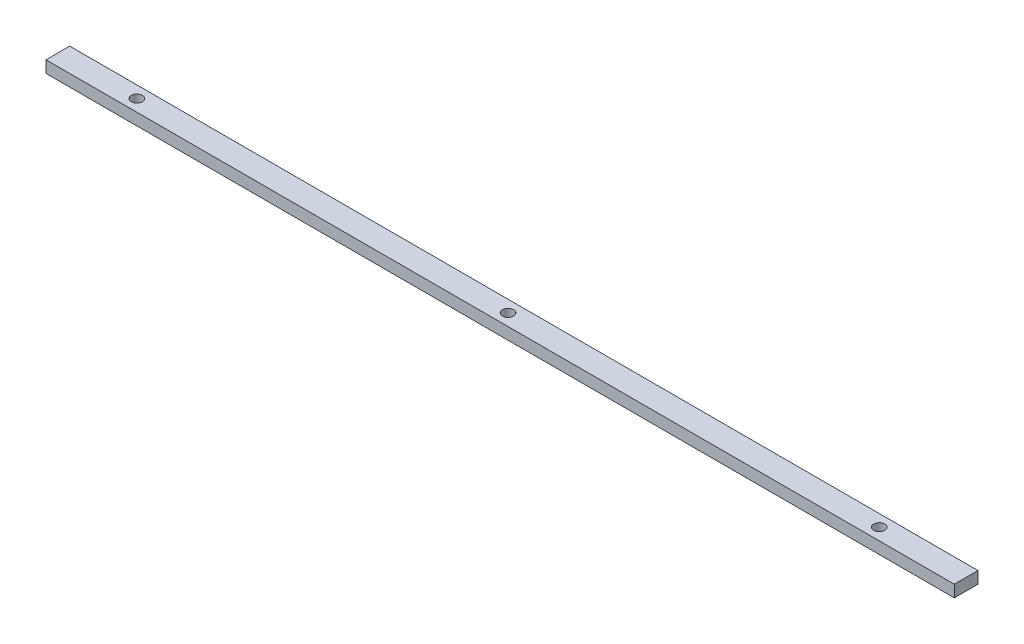
from build123d import *

# Parameters (mm, degrees)
SKETCH_1_W          = 1150
SKETCH_1_H          = 15
EXTRUDE_1_DEPTH     = 30
SKETCH_2_R          = 7
CUT_EXTRUDE_1_DEPTH = 1195.521313651


with BuildPart() as part:
    # Эскиз1 → Бобышка-Вытянуть1 (new body)
    with BuildSketch(Plane.XY):
        with Locations((619.050320868, 30.131091658)):
            Rectangle(SKETCH_1_W, SKETCH_1_H)
    extrude(amount=EXTRUDE_1_DEPTH)

    # Эскиз2 → Вырез-Вытянуть1 (cut, through all)
    with BuildSketch(Plane(origin=(0, 37.631091658, 0), x_dir=(1, 0, 0), z_dir=(0, 1, 0))):
        with Locations(Location((144.050320868, -15, 0), (0, 0, 270))):
            Circle(SKETCH_2_R)
        with Locations(Location((614.050320868, -15, 0), (0, 0, 270))):
            Circle(SKETCH_2_R)
        with Locations(Location((1084.050320868, -15, 0), (0, 0, 270))):
            Circle(SKETCH_2_R)
    extrude(amount=-CUT_EXTRUDE_1_DEPTH, mode=Mode.SUBTRACT)


solid = part.part
